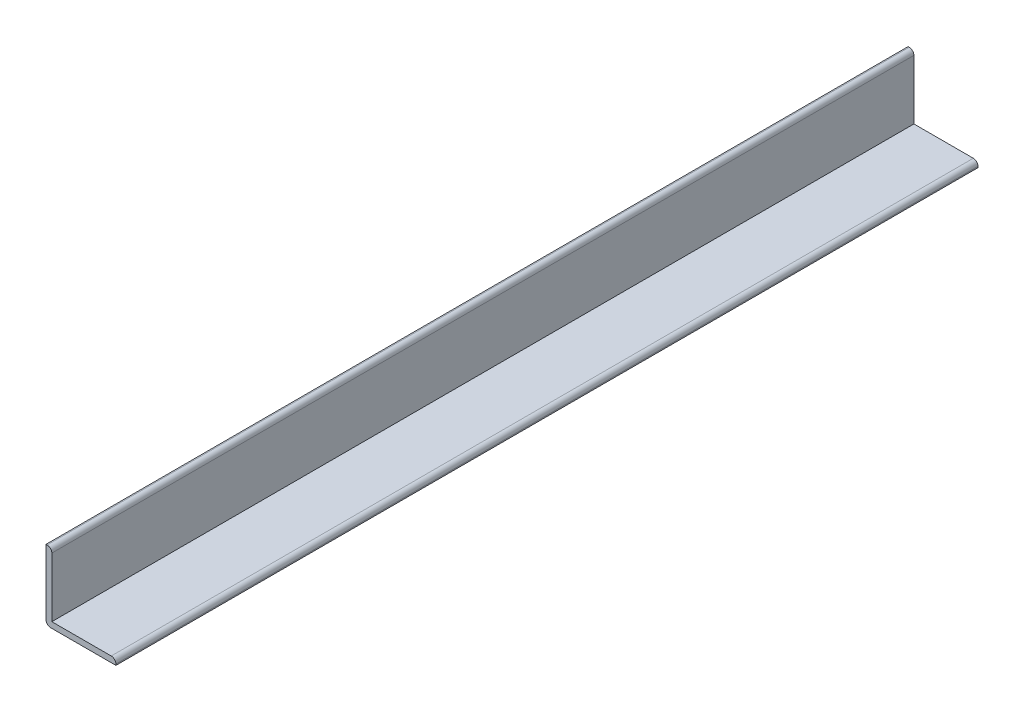
from build123d import *

# Parameters (mm, degrees)
BOSS_EXTRUDE1_DEPTH = 469.9


with BuildPart() as part:
    # Sketch1 → Boss-Extrude1 (new body)
    with BuildSketch(Plane.XY):
        with BuildLine():
            Line((0, 2.54), (0, 38.1))
            Line((0, 38.1), (0.635, 38.1))
            ThreePointArc((0.635, 38.1), (2.431051224, 37.356051224), (3.175, 35.56))
            Line((3.175, 35.56), (3.175, 3.175))
            Line((3.175, 3.175), (35.56, 3.175))
            ThreePointArc((35.56, 3.175), (37.356051224, 2.431051224), (38.1, 0.635))
            Line((38.1, 0.635), (38.1, 0))
            Line((38.1, 0), (2.54, 0))
            ThreePointArc((2.54, 0), (0.743948776, 0.743948776), (0, 2.54))
        make_face()
    extrude(amount=BOSS_EXTRUDE1_DEPTH)


solid = part.part
